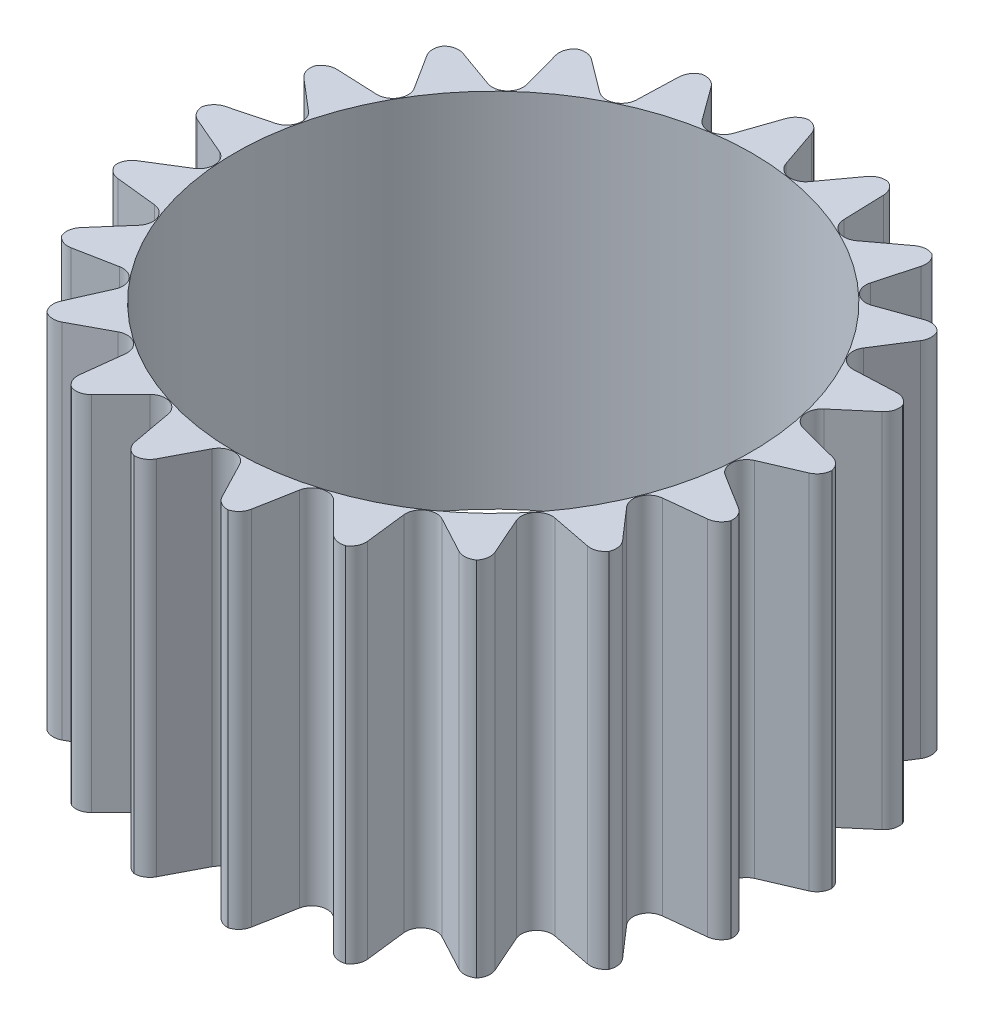
from build123d import *

# Parameters (mm, degrees)
SKETCH1_R           = 6.11
SKETCH1_R_2         = 5
BOSS_EXTRUDE1_DEPTH = 7
CUT_EXTRUDE2_REACH  = 13.12
CIRPATTERN1_COUNT   = 21


with BuildPart() as part:
    # Sketch1 → Boss-Extrude1 (new body)
    with BuildSketch(Plane(origin=(0, 0, 0), x_dir=(1, 0, 0), z_dir=(0, 1, 0))):
        with Locations(Location((0, 0, 0), (0, 0, 270))):
            Circle(SKETCH1_R)
        with Locations(Location((0, 0, 0), (0, 0, 270))):
            Circle(SKETCH1_R_2, mode=Mode.SUBTRACT)
    extrude(amount=BOSS_EXTRUDE1_DEPTH)

    # Sketch2 → Cut-Extrude2 (cut, up to next)
    with BuildSketch(Plane(origin=(0, 0, 0), x_dir=(1, 0, 0), z_dir=(0, 1, 0)), mode=Mode.PRIVATE) as cut_extrude2_sk1:
        with BuildLine():
            Line((0.634953715, -5.878485528), (0.265979235, -5.171237446))
            ThreePointArc((0.265979235, -5.171237446), (0, -5.01), (-0.265979235, -5.171237446))
            Line((-0.265979235, -5.171237446), (-0.634953715, -5.878485528))
            ThreePointArc((-0.634953715, -5.878485528), (-0.765837658, -6.007583501), (-0.947452724, -6.036094212))
            ThreePointArc((-0.947452724, -6.036094212), (0, -7.060330853), (0.947452724, -6.036094212))
            ThreePointArc((0.947452724, -6.036094212), (0.765837658, -6.007583501), (0.634953715, -5.878485528))
        make_face()
    cut_extrude2_tool1 = extrude(cut_extrude2_sk1.sketch, amount=CUT_EXTRUDE2_REACH, mode=Mode.PRIVATE) & part.part
    cut_extrude2 = cut_extrude2_tool1.solids().sort_by_distance((0, 0, 6.162495))[0]
    add(cut_extrude2, mode=Mode.SUBTRACT)

    # CirPattern1: Cut-Extrude2 ×21 about axis
    cirpattern1_axis = Axis((0, 0, 0), (0, 1, 0))
    for i in range(1, CIRPATTERN1_COUNT):
        add(cut_extrude2.rotate(cirpattern1_axis, i * 360 / CIRPATTERN1_COUNT), mode=Mode.SUBTRACT)


solid = part.part
